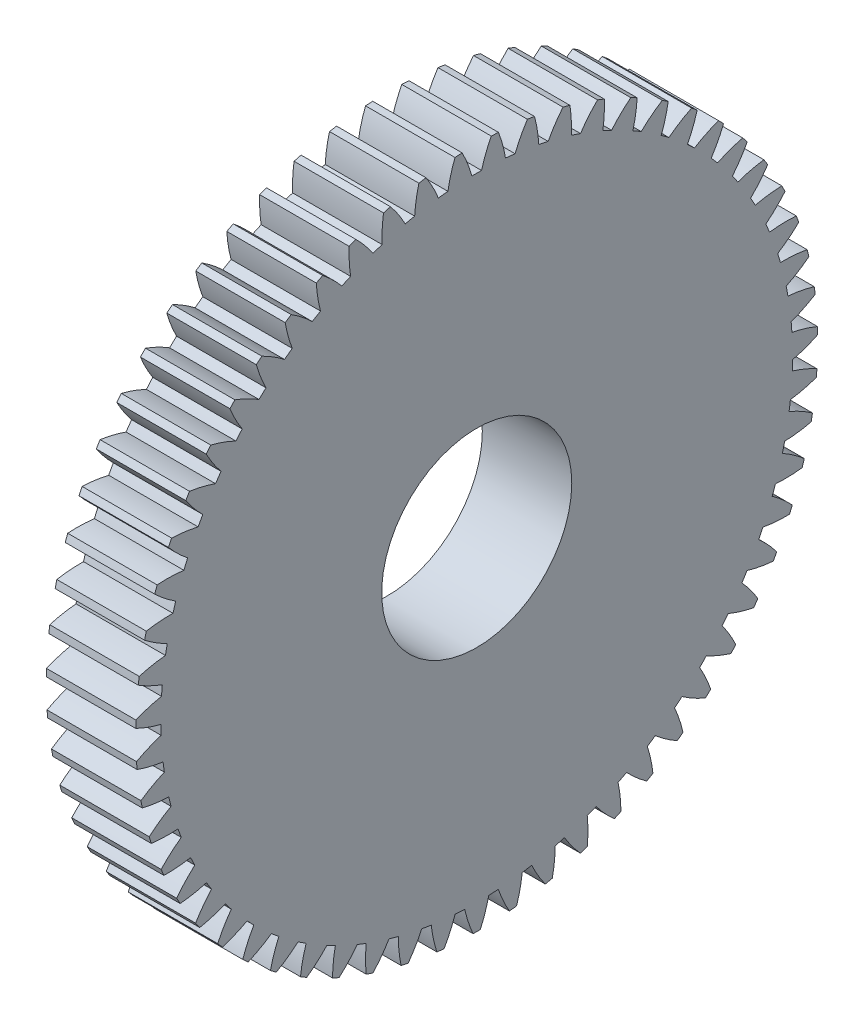
from build123d import *

# Parameters (mm, degrees)
BASPROSKE_W        = 4
BASPROSKE_H        = 15.25
TOOTHCUT_DEPTH     = 22.934561769
TEETHCUTS_COUNT    = 59
BORSKE_R           = 2.5
BORE_DEPTH         = 50.0000508
SKETCH1_R          = 4.25
CUT_EXTRUDE1_DEPTH = 10


with BuildPart() as part:
    # BasProSke → Base-Revolve (revolve)
    with BuildSketch(Plane(origin=(0, 0, 0), x_dir=(1, 0, 0), z_dir=(0, 1, 0)), mode=Mode.PRIVATE) as base_revolve_sk:
        with Locations((2, 7.625)):
            Rectangle(BASPROSKE_W, BASPROSKE_H)
    revolve(base_revolve_sk.sketch.rotate(Axis((-10, 0, 0), (1, 0, 0)), 180), axis=Axis((-10, 0, 0), (1, 0, 0)))

    # TooCutSke → ToothCut (cut, through all)
    with BuildSketch(Plane(origin=(0, 0, 0), x_dir=(0, 0, -1), z_dir=(1, 0, 0))):
        with BuildLine():
            ThreePointArc((0.215258607, 14.122359567), (0, 14.124), (-0.215258607, 14.122359567))
            ThreePointArc((-0.215258607, 14.122359567), (-0.409773942, 14.703323593), (-0.663487131, 15.260983913))
            ThreePointArc((-0.663487131, 15.260983913), (0, 15.2754), (0.663487131, 15.260983913))
            ThreePointArc((0.663487131, 15.260983913), (0.409773942, 14.703323593), (0.215258607, 14.122359567))
        make_face()
    toothcut = extrude(amount=TOOTHCUT_DEPTH, mode=Mode.SUBTRACT)

    # TeethCuts: ToothCut ×59 about axis
    teethcuts_axis = Axis((0, 0, 0), (1, 0, 0))
    for i in range(1, TEETHCUTS_COUNT):
        add(toothcut.rotate(teethcuts_axis, i * 360 / TEETHCUTS_COUNT), mode=Mode.SUBTRACT)

    # BorSke → Bore (cut, symmetric)
    with BuildSketch(Plane(origin=(0, 0, 0), x_dir=(0, 0, -1), z_dir=(1, 0, 0))):
        with Locations(Location((0, 0, 0), (0, 0, 180))):
            Circle(BORSKE_R)
    extrude(amount=BORE_DEPTH, both=True, mode=Mode.SUBTRACT)

    # Sketch1 → Cut-Extrude1 (cut)
    with BuildSketch(Plane(origin=(4, 0, 0), x_dir=(0, 0, -1), z_dir=(1, 0, 0))):
        Circle(SKETCH1_R)
    extrude(amount=-CUT_EXTRUDE1_DEPTH, mode=Mode.SUBTRACT)


solid = part.part
